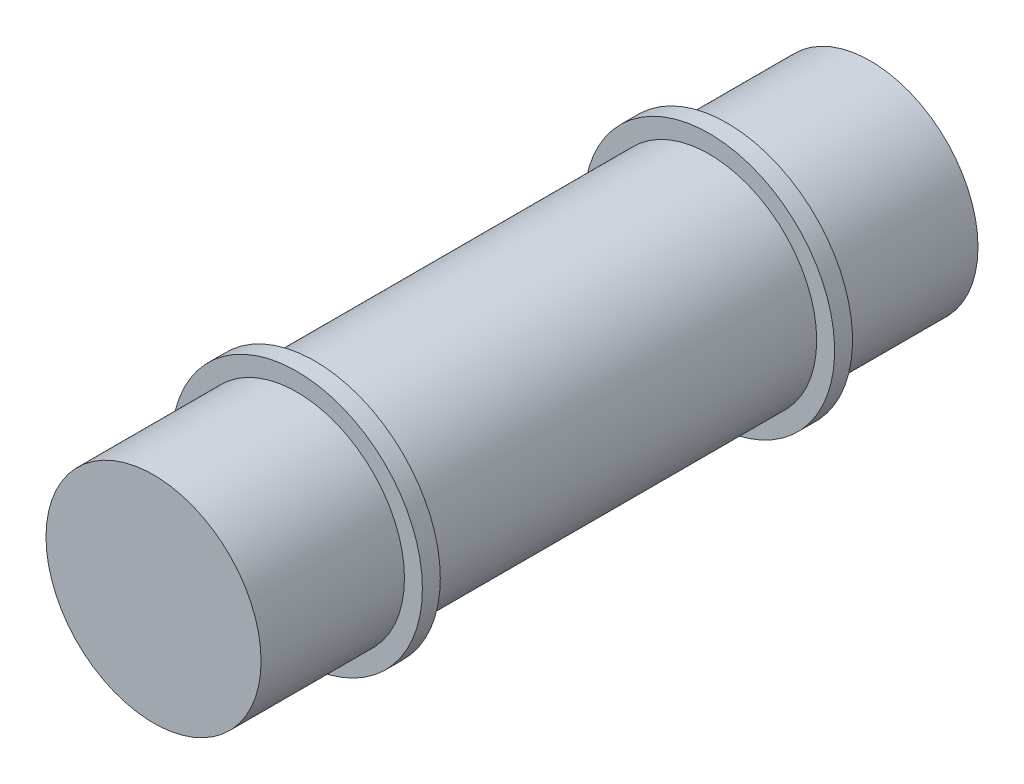
from build123d import *

# Parameters (mm, degrees)
ESQUISSE1_R        = 6
BOSS_EXTRU_1_DEPTH = 40
ESQUISSE2_R        = 7
ESQUISSE2_R_2      = 6
BOSS_EXTRU_2_DEPTH = 1
BOSS_EXTRU_3_START = -1
ESQUISSE3_R        = 7
ESQUISSE3_R_2      = 6
BOSS_EXTRU_3_DEPTH = 1


with BuildPart() as part:
    # Esquisse1 → Boss.-Extru.1 (new body)
    with BuildSketch(Plane.XY):
        Circle(ESQUISSE1_R)
    extrude(amount=BOSS_EXTRU_1_DEPTH)

    # Esquisse2 → Boss.-Extru.2 (add)
    with BuildSketch(Plane(origin=(0, 0, 8), x_dir=(-1, 0, 0), z_dir=(0, 0, -1))):
        Circle(ESQUISSE2_R)
        Circle(ESQUISSE2_R_2, mode=Mode.SUBTRACT)
    extrude(amount=-BOSS_EXTRU_2_DEPTH)

    # Esquisse3 → Boss.-Extru.3 (add)
    with BuildSketch(Plane.XY.offset(32).offset(BOSS_EXTRU_3_START)):
        with Locations(Location((0, 0, 0), (0, 0, 180))):
            Circle(ESQUISSE3_R)
        with Locations(Location((0, 0, 0), (0, 0, 180))):
            Circle(ESQUISSE3_R_2, mode=Mode.SUBTRACT)
    extrude(amount=BOSS_EXTRU_3_DEPTH)


solid = part.part
